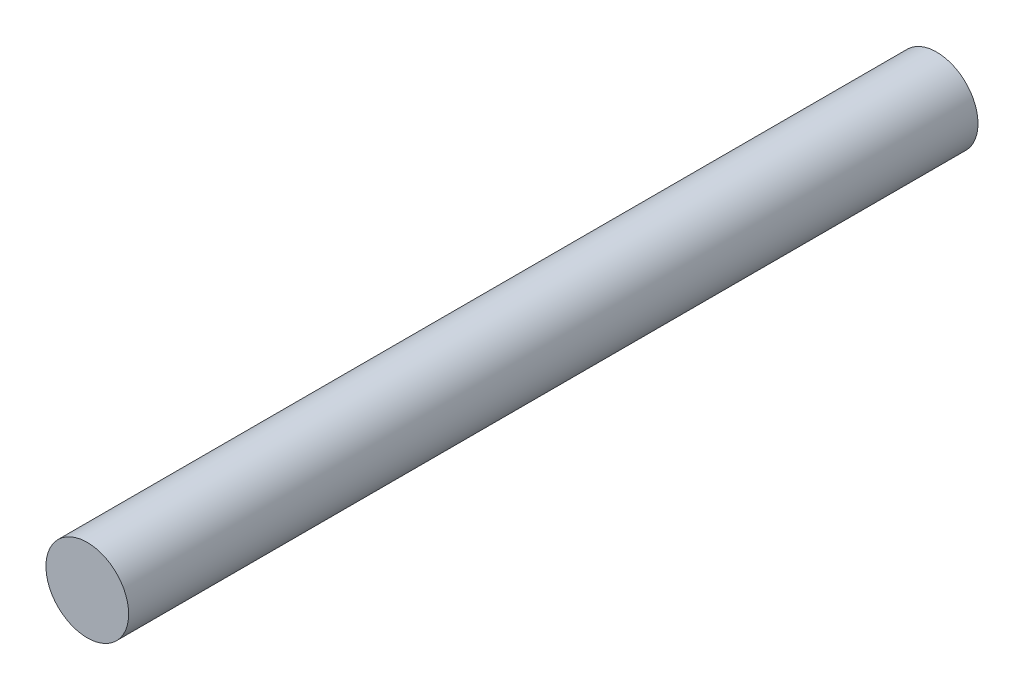
from build123d import *

# Parameters (mm, degrees)
SKETCH1_R           = 5.6
BOSS_EXTRUDE1_DEPTH = 115
SKETCH1_3_R         = 4.6
CUT_EXTRUDE1_DEPTH  = 113
SKETCH2_W           = 5.5
SKETCH2_H           = 1.489117796
CUT_EXTRUDE2_DEPTH  = 55


with BuildPart() as part:
    # Sketch1 → Boss-Extrude1 (new body)
    with BuildSketch(Plane.XY):
        Circle(SKETCH1_R)
    extrude(amount=BOSS_EXTRUDE1_DEPTH)

    # Sketch1<3> → Cut-Extrude1 (cut)
    with BuildSketch(Plane.XY):
        Circle(SKETCH1_3_R)
    extrude(amount=CUT_EXTRUDE1_DEPTH, mode=Mode.SUBTRACT)

    # Sketch2 → Cut-Extrude2 (cut)
    with BuildSketch(Plane.XY.offset(85)):
        with Locations((0, -5.6)):
            Rectangle(SKETCH2_W, SKETCH2_H)
    extrude(amount=-CUT_EXTRUDE2_DEPTH, mode=Mode.SUBTRACT)


solid = part.part
